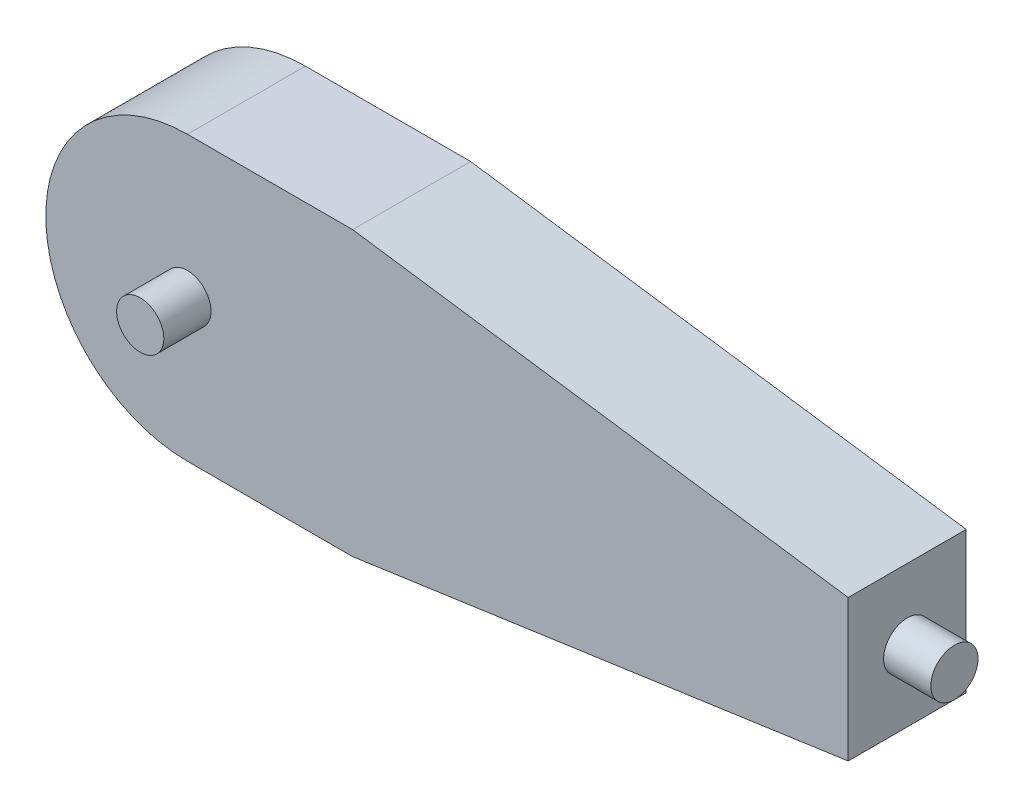
from build123d import *

# Parameters (mm, degrees)
BOSS_EXTRUDE1_DEPTH = 50
SKETCH2_R           = 10
BOSS_EXTRUDE2_DEPTH = 20
SKETCH3_R           = 10
BOSS_EXTRUDE3_DEPTH = 20


with BuildPart() as part:
    # Sketch1 → Boss-Extrude1 (new body)
    with BuildSketch(Plane.XY):
        with BuildLine():
            Line((0, 60), (70, 60))
            Line((70, 60), (280, 30))
            Line((280, 30), (280, -30))
            Line((280, -30), (70, -60))
            Line((70, -60), (0, -60))
            ThreePointArc((0, -60), (-60, 0), (0, 60))
        make_face()
    extrude(amount=BOSS_EXTRUDE1_DEPTH)

    # Sketch2 → Boss-Extrude2 (add)
    with BuildSketch(Plane.XY.offset(50)):
        Circle(SKETCH2_R)
    extrude(amount=BOSS_EXTRUDE2_DEPTH)

    # Sketch3 → Boss-Extrude3 (add)
    with BuildSketch(Plane(origin=(280, 0, 0), x_dir=(0, 0, -1), z_dir=(1, 0, 0))):
        with Locations(Location((-25, 0, 0), (0, 0, 180))):
            Circle(SKETCH3_R)
    extrude(amount=BOSS_EXTRUDE3_DEPTH)


solid = part.part
